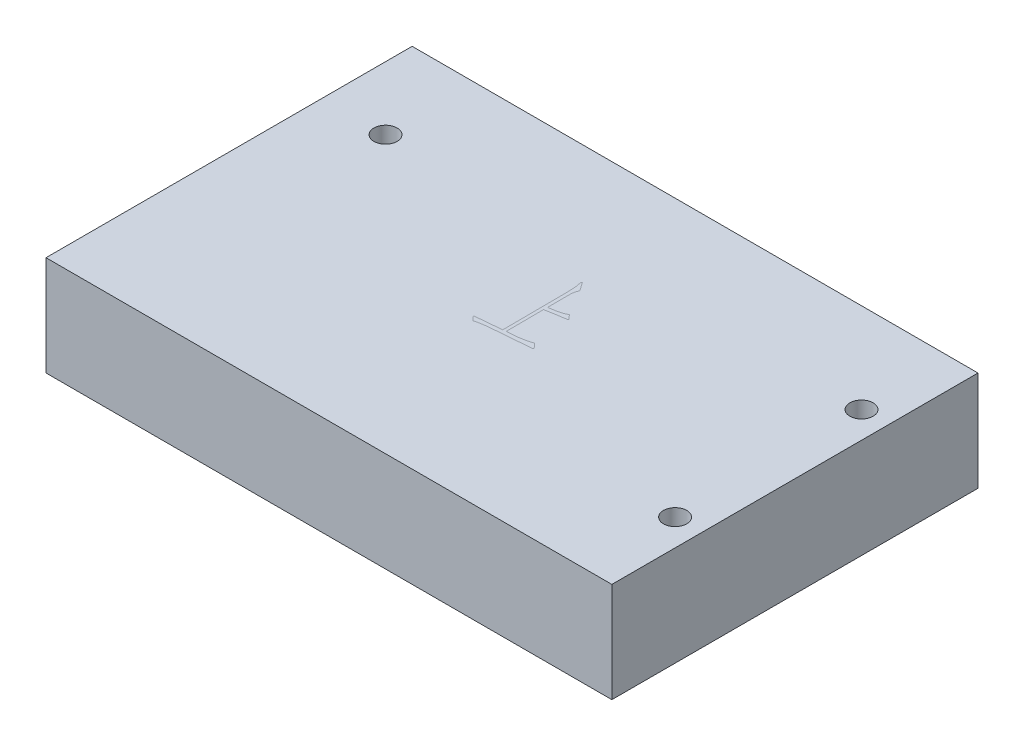
from build123d import *

# Parameters (mm, degrees)
SKETCH_1_W      = 85
SKETCH_1_H      = 55
SKETCH_1_R      = 1.75
EXTRUDE_1_DEPTH = 15


with BuildPart() as part:
    # 草图1 → 凸台-拉伸1 (new body)
    with BuildSketch(Plane(origin=(0, 0, 0), x_dir=(1, 0, 0), z_dir=(0, 1, 0))):
        with Locations((42.5, 27.5)):
            Rectangle(SKETCH_1_W, SKETCH_1_H)
        with Locations(Location((81, 41.5, 0), (0, 0, 270))):
            Circle(SKETCH_1_R, mode=Mode.SUBTRACT)
        with Locations(Location((81, 13.5, 0), (0, 0, 270))):
            Circle(SKETCH_1_R, mode=Mode.SUBTRACT)
        with Locations(Location((9.5, 41.5, 0), (0, 0, 270))):
            Circle(SKETCH_1_R, mode=Mode.SUBTRACT)
    extrude(amount=EXTRUDE_1_DEPTH)


solid = part.part
